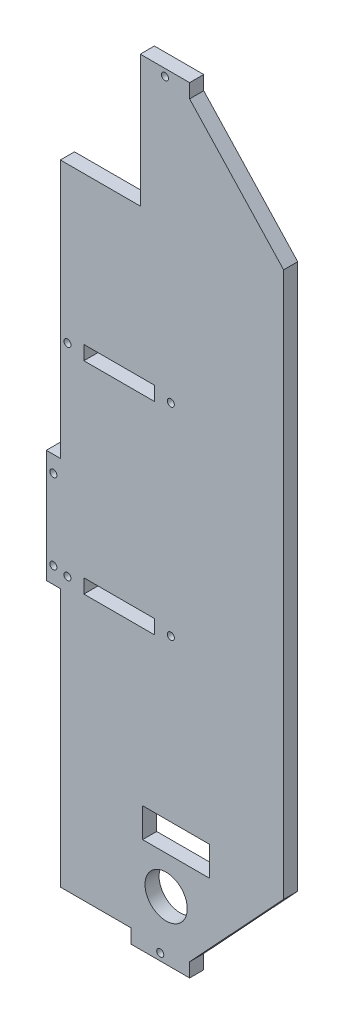
from build123d import *

# Parameters (mm, degrees)
ESQUISSE1_W              = 148
ESQUISSE1_H              = 330
BOSS_EXTRU_1_DEPTH       = 6
ESQUISSE2_W              = 30
ESQUISSE2_H              = 6
ESQUISSE2_W_2            = 6
ESQUISSE2_H_2            = 40
ENL_V_MAT_EXTRU_1_DEPTH  = 6
ESQUISSE6_W              = 6
ESQUISSE6_H              = 60
ENL_V_MAT_EXTRU_4_DEPTH  = 10
ESQUISSE8_W              = 6
ESQUISSE8_H              = 330
BOSS_EXTRU_2_DEPTH       = 57
ENL_V_MAT_EXTRU_5_DEPTH  = 389.536999525
ESQUISSE10_W             = 30
ESQUISSE10_H             = 6
ENL_V_MAT_EXTRU_6_DEPTH  = 389.536999525
ENL_V_MAT_EXTRU_9_DEPTH  = 389.536999525
ENL_V_MAT_EXTRU_11_DEPTH = 10
ESQUISSE16_R             = 1.5
ENL_V_MAT_EXTRU_12_DEPTH = 6
ESQUISSE17_R             = 2.995
ENL_V_MAT_EXTRU_13_DEPTH = 3
ESQUISSE18_R             = 9
ESQUISSE18_W             = 28.5
ESQUISSE18_H             = 12.5
ENL_V_MAT_EXTRU_14_DEPTH = 389.536999525
ESQUISSE5_W              = 30
ESQUISSE5_H              = 6
ESQUISSE5_H_2            = 3
ENL_V_MAT_EXTRU_15_DEPTH = 389.536999525


with BuildPart() as part:
    # Esquisse1 → Boss.-Extru.1 (new body)
    with BuildSketch(Plane.XY):
        with Locations((74, 165)):
            Rectangle(ESQUISSE1_W, ESQUISSE1_H)
    extrude(amount=BOSS_EXTRU_1_DEPTH)

    # Esquisse2 → Enlèv. mat.-Extru.1 (cut)
    with BuildSketch(Plane.XY.offset(6)):
        with Locations((45, 3)):
            Rectangle(ESQUISSE2_W, ESQUISSE2_H)
        with Locations((125, 3)):
            Rectangle(ESQUISSE2_W, ESQUISSE2_H)
        with Locations((45, 327)):
            Rectangle(ESQUISSE2_W, ESQUISSE2_H)
        with Locations((117, 327)):
            Rectangle(ESQUISSE2_W, ESQUISSE2_H)
        with Locations((3, 245)):
            Rectangle(ESQUISSE2_W_2, ESQUISSE2_H_2)
        with Locations((3, 165)):
            Rectangle(ESQUISSE2_W_2, ESQUISSE2_H_2)
        with Locations((3, 85)):
            Rectangle(ESQUISSE2_W_2, ESQUISSE2_H_2)
    extrude(amount=-ENL_V_MAT_EXTRU_1_DEPTH, mode=Mode.SUBTRACT)

    # Esquisse6 → Enlèv. mat.-Extru.4 (cut)
    with BuildSketch(Plane.XY.offset(6)):
        with Locations((107, 86)):
            Rectangle(ESQUISSE6_W, ESQUISSE6_H)
        with Locations((107, 194)):
            Rectangle(ESQUISSE6_W, ESQUISSE6_H)
    extrude(amount=-ENL_V_MAT_EXTRU_4_DEPTH, mode=Mode.SUBTRACT)

    # Esquisse8 → Boss.-Extru.2 (add)
    with BuildSketch(Plane(origin=(148, 0, 0), x_dir=(0, 0, -1), z_dir=(1, 0, 0))):
        with Locations((-3, 165)):
            Rectangle(ESQUISSE8_W, ESQUISSE8_H)
    extrude(amount=BOSS_EXTRU_2_DEPTH)

    # Esquisse9 → Enlèv. mat.-Extru.5 (cut, through all)
    with BuildSketch(Plane.XY.offset(6)):
        Polygon((165, 0), (205, 0), (205, 49), (165, 6), align=None)
        Polygon((165, 330), (205, 330), (205, 281), (165, 324), align=None)
    extrude(amount=-ENL_V_MAT_EXTRU_5_DEPTH, mode=Mode.SUBTRACT)

    # Esquisse10 → Enlèv. mat.-Extru.6 (cut, through all)
    with BuildSketch(Plane.XY.offset(6)):
        with Locations((135, 208)):
            Rectangle(ESQUISSE10_W, ESQUISSE10_H)
        with Locations((135, 122)):
            Rectangle(ESQUISSE10_W, ESQUISSE10_H)
    extrude(amount=-ENL_V_MAT_EXTRU_6_DEPTH, mode=Mode.SUBTRACT)

    # Esquisse13 → Enlèv. mat.-Extru.9 (cut, through all)
    with BuildSketch(Plane(origin=(0, 0, 0), x_dir=(-1, 0, 0), z_dir=(0, 0, -1))):
        Polygon((-88, 330), (-144, 330), (-144, 274), (-110, 274), (-110, 280), (-88, 280), align=None)
    extrude(amount=-ENL_V_MAT_EXTRU_9_DEPTH, mode=Mode.SUBTRACT)

    # Esquisse15 → Enlèv. mat.-Extru.11 (cut)
    with BuildSketch(Plane(origin=(0, 0, 0), x_dir=(-1, 0, 0), z_dir=(0, 0, -1))):
        Polygon((-110, 0), (-110, 116), (-104, 116), (-104, 164), (-110, 164), (-110, 280), (-88, 280), (-88, 330), (0, 330), (0, 0), align=None)
    extrude(amount=-ENL_V_MAT_EXTRU_11_DEPTH, mode=Mode.SUBTRACT)

    # Esquisse16 → Enlèv. mat.-Extru.12 (cut)
    with BuildSketch(Plane(origin=(0, 0, 0), x_dir=(-1, 0, 0), z_dir=(0, 0, -1))):
        with Locations((-152.5, 3)):
            Circle(ESQUISSE16_R)
        with Locations((-107, 123)):
            Circle(ESQUISSE16_R)
        with Locations((-107, 157)):
            Circle(ESQUISSE16_R)
        with Locations((-154.5, 327)):
            Circle(ESQUISSE16_R)
        with Locations((-157, 122)):
            Circle(ESQUISSE16_R)
        with Locations((-157, 208)):
            Circle(ESQUISSE16_R)
        with Locations((-113, 122)):
            Circle(ESQUISSE16_R)
        with Locations((-113, 208)):
            Circle(ESQUISSE16_R)
    extrude(amount=-ENL_V_MAT_EXTRU_12_DEPTH, mode=Mode.SUBTRACT)

    # Esquisse17 → Enlèv. mat.-Extru.13 (cut)
    with BuildSketch(Plane(origin=(0, 0, 0), x_dir=(-1, 0, 0), z_dir=(0, 0, -1))):
        with Locations((-152.5, 3)):
            Circle(ESQUISSE17_R)
        with Locations((-107, 123)):
            Circle(ESQUISSE17_R)
        with Locations((-107, 157)):
            Circle(ESQUISSE17_R)
        with Locations((-154.5, 327)):
            Circle(ESQUISSE17_R)
    extrude(amount=-ENL_V_MAT_EXTRU_13_DEPTH, mode=Mode.SUBTRACT)

    # Esquisse18 → Enlèv. mat.-Extru.14 (cut, through all)
    with BuildSketch(Plane(origin=(0, 0, 0), x_dir=(-1, 0, 0), z_dir=(0, 0, -1))):
        with Locations((-155, 25)):
            Circle(ESQUISSE18_R)
        with Locations((-159.25, 47.25)):
            Rectangle(ESQUISSE18_W, ESQUISSE18_H)
    extrude(amount=-ENL_V_MAT_EXTRU_14_DEPTH, mode=Mode.SUBTRACT)

    # Esquisse5 → Enlèv. mat.-Extru.15 (cut, through all)
    with BuildSketch(Plane.XY.offset(6)):
        with Locations((56.5, 277)):
            Rectangle(ESQUISSE5_W, ESQUISSE5_H)
        with Locations((56.5, 133.5)):
            Rectangle(ESQUISSE5_W, ESQUISSE5_H_2)
    extrude(amount=-ENL_V_MAT_EXTRU_15_DEPTH, mode=Mode.SUBTRACT)


solid = part.part
